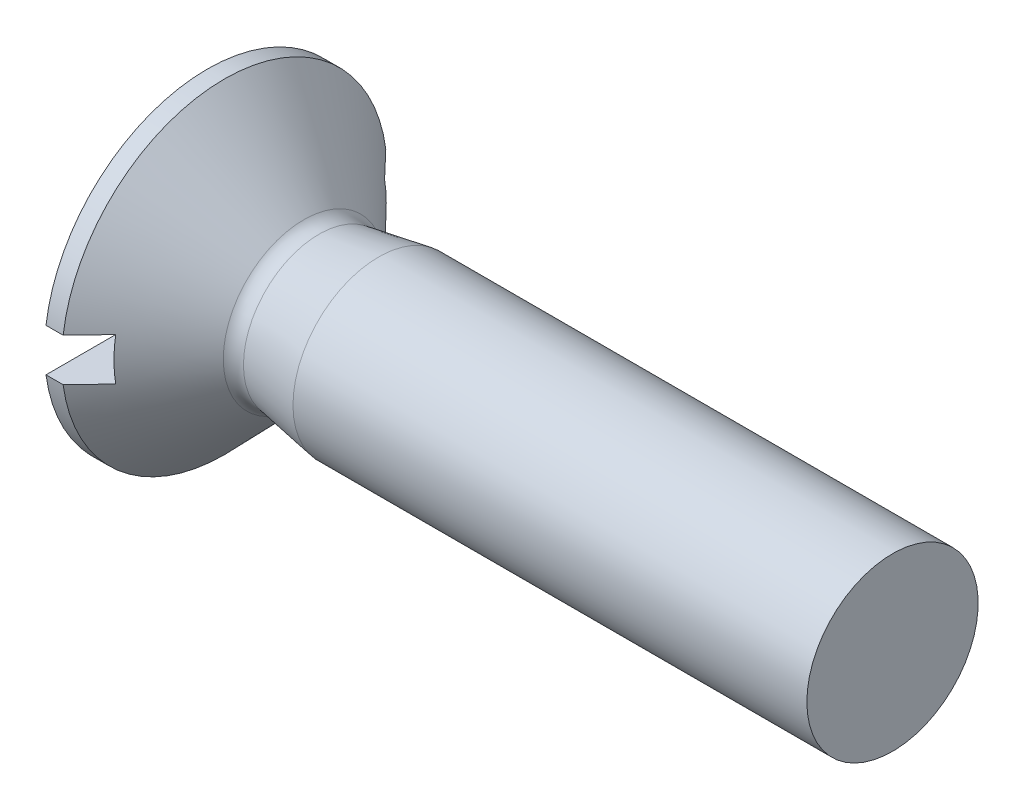
from build123d import *

# Parameters (mm, degrees)
CUT_EXTRUDE_1_DEPTH      = 9.439194274
CUT_EXTRUDE_1_DEPTH_BACK = 9.439194274
SKETCH_3_W               = 0.5
SKETCH_3_H               = 0.5


with BuildPart() as part:
    # Эскиз2 → Повернуть1 (revolve)
    with BuildSketch(Plane.XY, mode=Mode.PRIVATE) as revolve_1_sk:
        with BuildLine():
            Line((0, 0), (0, 1.9))
            Line((0, 1.9), (0.2, 1.9))
            Line((0.2, 1.9), (1.126725855, 0.940347284))
            ThreePointArc((1.126725855, 0.940347284), (1.20815228, 0.889276183), (1.304000388, 0.882088693))
            Line((1.304000388, 0.882088693), (2, 1))
            Line((2, 1), (8, 1))
            Line((8, 1), (8, 0))
            Line((8, 0), (0, 0))
        make_face()
    revolve(revolve_1_sk.sketch.rotate(Axis((0, 0, 0), (1, 0, 0)), 90), axis=Axis((0, 0, 0), (1, 0, 0)))

    # Эскиз3 → Вырез-Вытянуть1 (cut, two sides: drawn at the far end of the back side and taken through both)
    with BuildSketch(Plane.XY.offset(-CUT_EXTRUDE_1_DEPTH_BACK)):
        with Locations((0.25, 0)):
            Rectangle(SKETCH_3_W, SKETCH_3_H)
    extrude(amount=CUT_EXTRUDE_1_DEPTH + CUT_EXTRUDE_1_DEPTH_BACK, mode=Mode.SUBTRACT)


solid = part.part
